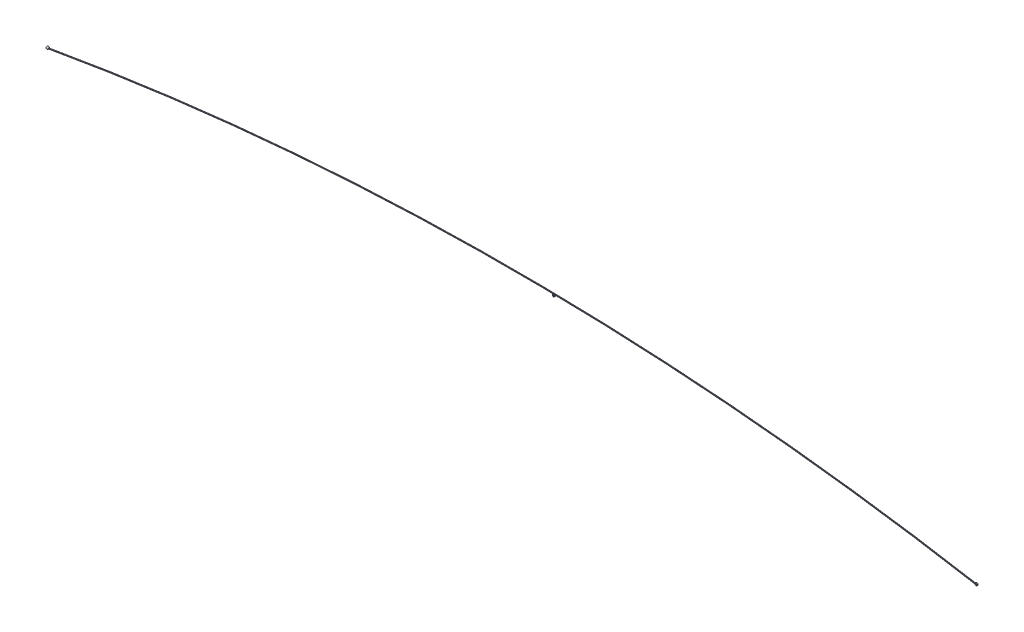
from build123d import *

# Parameters (mm, degrees)
SALIENTE_EXTRUIR1_DEPTH      = 0.5
SALIENTE_EXTRUIR1_DEPTH_BACK = 0.5
CROQUIS4_R                   = 1.25
CROQUIS4_R_2                 = 0.75


with BuildPart() as part:
    # Barrer1: sweep along a path in Croquis1
    with BuildLine(Plane.XY) as barrer1_path:
        ThreePointArc((-980, 0), (-490, 43.052223117), (0, 0))
    # Croquis2 → Barrer1 (sweep)
    with BuildSketch(Plane(origin=(0, 0, 0), x_dir=(0, 0, -1), z_dir=(1, 0, 0))):
        Polygon((0, 0.5), (-0.433012702, 0.25), (-0.433012702, -0.25), (0, -0.5), (0.433012702, -0.25), (0.433012702, 0.25), align=None)
    sweep(path=barrer1_path.line)

    # Croquis3 → Revolución1 (revolve)
    with BuildSketch(Plane.XY):
        with BuildLine():
            Line((-981.749968129, 0.25), (-979.249968129, 0.25))
            ThreePointArc((-979.249968129, 0.25), (-980.499968129, 1.5), (-981.749968129, 0.25))
        make_face()
    revolve(axis=Axis((-981.749968129, 0.25, 0), (1, 0, 0)))

    # Croquis4 → Saliente-Extruir1 (add, two sides: drawn at the far end of the back side and taken through both)
    # profile 1 of 2: a face of its own
    with BuildSketch(Plane.XY.offset(-SALIENTE_EXTRUIR1_DEPTH_BACK)):
        with Locations((1, 0)):
            Circle(CROQUIS4_R)
        with Locations((1, 0)):
            Circle(CROQUIS4_R_2, mode=Mode.SUBTRACT)
    # profile 2 of 2: a face of its own
    with BuildSketch(Plane.XY.offset(-SALIENTE_EXTRUIR1_DEPTH_BACK)):
        with Locations((-445.44, 41.2)):
            Circle(CROQUIS4_R)
        with Locations((-445.44, 41.2)):
            Circle(CROQUIS4_R_2, mode=Mode.SUBTRACT)
    extrude(amount=SALIENTE_EXTRUIR1_DEPTH + SALIENTE_EXTRUIR1_DEPTH_BACK)


solid = part.part
